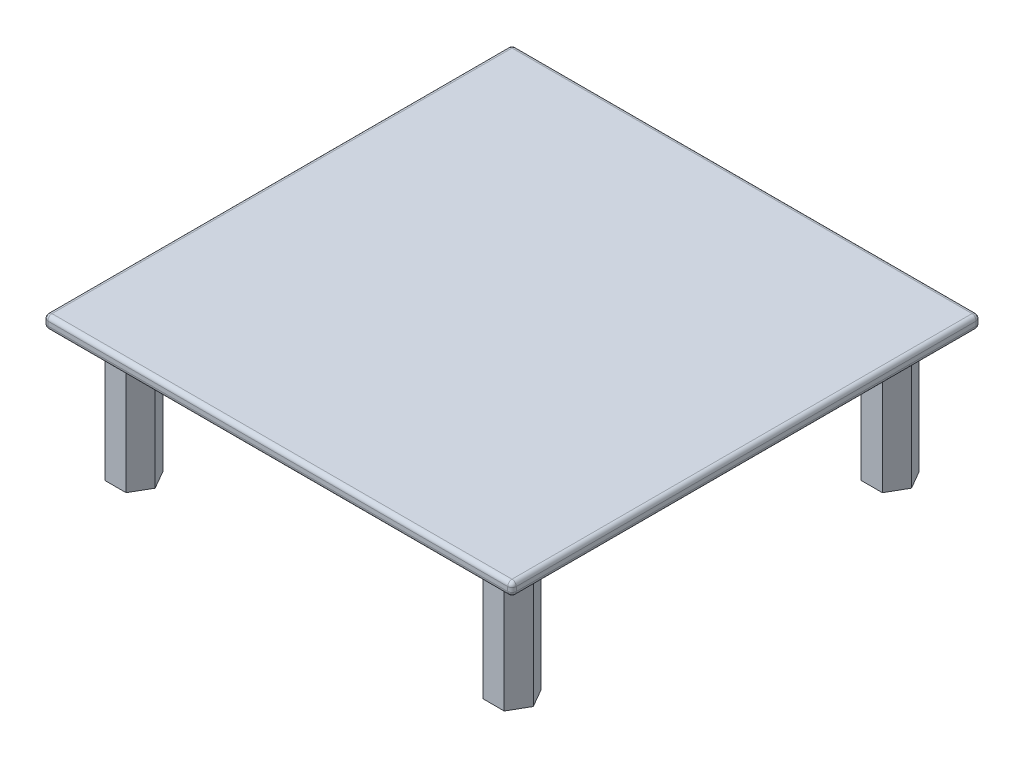
from build123d import *

# Parameters (mm, degrees)
SKETCH1_W           = 110
SKETCH1_H           = 110
BOSS_EXTRUDE1_DEPTH = 3
BOSS_EXTRUDE2_START = -2
BOSS_EXTRUDE2_DEPTH = 32
FILLET2_R           = 1


with BuildPart() as part:
    # Sketch1 → Boss-Extrude1 (new body)
    with BuildSketch(Plane(origin=(0, 0, 0), x_dir=(1, 0, 0), z_dir=(0, 1, 0))):
        Rectangle(SKETCH1_W, SKETCH1_H)
    extrude(amount=BOSS_EXTRUDE1_DEPTH)

    # Sketch2 → Boss-Extrude2 (add)
    with BuildSketch(Plane.XZ.offset(BOSS_EXTRUDE2_START)):
        Polygon((-39.393398282, 44.393398282), (-41.893398282, 48.723525301), (-46.893398282, 48.723525301), (-49.393398282, 44.393398282), (-46.893398282, 40.063271263), (-41.893398282, 40.063271263), align=None)
        Polygon((41.893398282, 40.063271263), (39.393398282, 44.393398282), (41.893398282, 48.723525301), (46.893398282, 48.723525301), (49.393398282, 44.393398282), (46.893398282, 40.063271263), align=None)
        Polygon((39.393398282, -44.393398282), (41.893398282, -48.723525301), (46.893398282, -48.723525301), (49.393398282, -44.393398282), (46.893398282, -40.063271263), (41.893398282, -40.063271263), align=None)
        Polygon((-41.893398282, -40.063271263), (-39.393398282, -44.393398282), (-41.893398282, -48.723525301), (-46.893398282, -48.723525301), (-49.393398282, -44.393398282), (-46.893398282, -40.063271263), align=None)
    extrude(amount=BOSS_EXTRUDE2_DEPTH)

    # Fillet2
    fillet2_edges = [part.edges().sort_by_distance(p)[0] for p in [
        (55, 3, 0),
        (0, 3, -55),
        (-55, 3, 0),
        (0, 0, -55),
        (55, 0, 0),
        (0, 0, 55),
        (-55, 0, 0),
        (-55, 1.5, -55),
        (55, 1.5, -55),
        (55, 1.5, 55),
        (-55, 1.5, 55),
        (0, 3, 55),
    ]]
    fillet(fillet2_edges, radius=FILLET2_R)


solid = part.part
